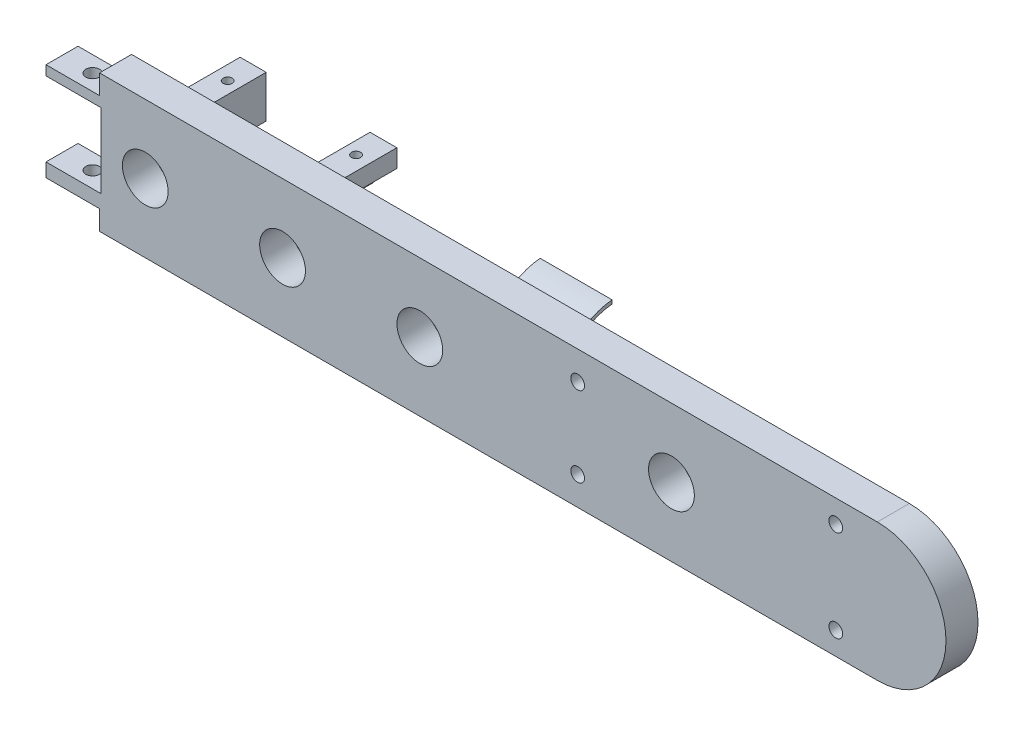
from build123d import *

# Parameters (mm, degrees)
BOSS_EXTRUDE1_DEPTH      = 7
SKETCH2_R                = 5
CUT_EXTRUDE1_DEPTH       = 7
LPATTERN1_COUNT          = 7
LPATTERN1_PITCH          = 30
SKETCH6_R                = 5
CUT_EXTRUDE2_DEPTH       = 10
BOSS_EXTRUDE2_DEPTH      = 21
CUT_EXTRUDE3_DEPTH       = 21
CUT_EXTRUDE4_REACH       = 220.014
SKETCH9_R                = 1.5
CUT_EXTRUDE5_REACH       = 220.771
SKETCH10_W               = 5.271518542
SKETCH10_H               = 23.219312301
BOSS_EXTRUDE3_DEPTH      = 14
CUT_EXTRUDE6_DEPTH       = 1
CUT_EXTRUDE6_DEPTH_BACK  = 22
SKETCH12_W               = 22.7
SKETCH12_H               = 14.642587258
SKETCH12_H_2             = 12.3
CUT_EXTRUDE7_DEPTH       = 7
CUT_EXTRUDE7_DEPTH_BACK  = 7
SKETCH13_R               = 1
CUT_EXTRUDE8_REACH       = 184.393
SKETCH14_W               = 12
SKETCH14_H               = 12
CUT_EXTRUDE11_DEPTH      = 219.013742346
CUT_EXTRUDE11_DEPTH_BACK = 219.013742346
SKETCH16_W               = 140
SKETCH16_H               = 37.19308959
SKETCH17_W               = 7
SKETCH17_H               = 21.4
BOSS_EXTRUDE4_DEPTH      = 11.7
CUT_EXTRUDE12_REACH      = 94.641
SKETCH18_R               = 1.5
CUT_EXTRUDE13_REACH      = 95.925
SKETCH20_W               = 15.728481458
SKETCH20_H               = 11.090838969
SKETCH21_W               = 7
SKETCH21_H               = 16.279991403
CUT_EXTRUDE14_DEPTH      = 12
BOSS_EXTRUDE5_DEPTH      = 7
CUT_EXTRUDE15_DEPTH      = 116.935326799
CUT_EXTRUDE15_DEPTH_BACK = 7
SKETCH23_R               = 1.5


with BuildPart() as part:
    # Sketch1 → Boss-Extrude1 (new body)
    with BuildSketch(Plane.XY):
        with BuildLine():
            Line((-200, 0), (50, 0))
            ThreePointArc((50, 0), (65, -15), (50, -30))
            Line((50, -30), (-200, -30))
            ThreePointArc((-200, -30), (-215, -15), (-200, 0))
        make_face()
    extrude(amount=BOSS_EXTRUDE1_DEPTH)

    # Sketch2 → Cut-Extrude1 (cut)
    with BuildSketch(Plane.XY.offset(7)):
        with Locations((-185, -15)):
            Circle(SKETCH2_R)
    cut_extrude1 = extrude(amount=-CUT_EXTRUDE1_DEPTH, mode=Mode.SUBTRACT)

    # LPattern1: Cut-Extrude1 ×7
    with Locations(*[(i * LPATTERN1_PITCH, 0, 0) for i in range(1, LPATTERN1_COUNT)]):
        add(cut_extrude1, mode=Mode.SUBTRACT)

    # Sketch6 → Cut-Extrude2 (cut)
    with BuildSketch(Plane(origin=(0, 0, 0), x_dir=(-1, 0, 0), z_dir=(0, 0, -1))):
        with Locations((-50, -15)):
            Circle(SKETCH6_R)
    extrude(amount=-CUT_EXTRUDE2_DEPTH, mode=Mode.SUBTRACT)

    # Sketch7 → Boss-Extrude2 (add)
    with BuildSketch(Plane(origin=(0, 0, 0), x_dir=(0, 0, -1), z_dir=(1, 0, 0))):
        with BuildLine():
            Line((20.124409349, -8.046570755), (20.124409349, -21.391782887))
            ThreePointArc((20.124409349, -21.391782887), (10.062204675, -26.149434806), (0, -21.391782887))
            Line((0, -21.391782887), (0, -8.046570755))
            ThreePointArc((0, -8.046570755), (10.062204675, -2.930122505), (20.124409349, -8.046570755))
        make_face()
    extrude(amount=BOSS_EXTRUDE2_DEPTH)

    # Sketch8 → Cut-Extrude3 (cut)
    with BuildSketch(Plane(origin=(21, 0, 0), x_dir=(0, 0, -1), z_dir=(1, 0, 0))):
        with BuildLine():
            Line((0.343653188, -8.603738845), (0.343653188, -21.003738845))
            Line((0.343653188, -21.003738845), (3.251608919, -23.33010343))
            Line((3.251608919, -23.33010343), (6.11482687, -24.672236845))
            Line((6.11482687, -24.672236845), (10.141227113, -25.388041332))
            Line((10.141227113, -25.388041332), (14.122889575, -24.672236845))
            Line((14.122889575, -24.672236845), (17.165058648, -23.33010343))
            Line((17.165058648, -23.33010343), (19.670374355, -20.953281344))
            Line((19.670374355, -20.953281344), (19.670374355, -8.553281344))
            ThreePointArc((19.670374355, -8.553281344), (9.994377841, -3.738573545), (0.343653188, -8.603738845))
        make_face()
    extrude(amount=-CUT_EXTRUDE3_DEPTH, mode=Mode.SUBTRACT)

    # Sketch9 → Cut-Extrude4 (cut, up to next)
    with BuildSketch(Plane(origin=(0, 0, 0), x_dir=(-1, 0, 0), z_dir=(0, 0, -1)), mode=Mode.PRIVATE) as cut_extrude4_sk1:
        with Locations((-29.5, -6.25)):
            Circle(SKETCH9_R)
    cut_extrude4_tool1 = extrude(cut_extrude4_sk1.sketch, amount=-CUT_EXTRUDE4_REACH, mode=Mode.PRIVATE) & part.part
    # Sketch9 → Cut-Extrude4 (cut, up to next)
    with BuildSketch(Plane(origin=(0, 0, 0), x_dir=(-1, 0, 0), z_dir=(0, 0, -1)), mode=Mode.PRIVATE) as cut_extrude4_sk2:
        with Locations((-29.5, -23.75)):
            Circle(SKETCH9_R)
    cut_extrude4_tool2 = extrude(cut_extrude4_sk2.sketch, amount=-CUT_EXTRUDE4_REACH, mode=Mode.PRIVATE) & part.part
    add(cut_extrude4_tool1.solids().sort_by_distance((29.5, -6.25, 0))[0], mode=Mode.SUBTRACT)
    add(cut_extrude4_tool2.solids().sort_by_distance((29.5, -23.75, 0))[0], mode=Mode.SUBTRACT)

    # Cut-Extrude5: up to this face of the body (flat: up to its plane)
    cut_extrude5_end = Plane(part.part.faces().sort_by_distance((-78.33059512, -15.01080435, 0))[0])
    # Sketch10 → Cut-Extrude5 (cut, up to the picked face)
    with BuildSketch(Plane(origin=(0, 0, -20.124409349), x_dir=(-1, 0, 0), z_dir=(0, 0, -1)), mode=Mode.PRIVATE) as cut_extrude5_sk1:
        with Locations((-2.635759271, -14.539778656)):
            Rectangle(SKETCH10_W, SKETCH10_H)
    cut_extrude5_tool1 = split(extrude(cut_extrude5_sk1.sketch, amount=-CUT_EXTRUDE5_REACH, mode=Mode.PRIVATE), bisect_by=cut_extrude5_end, keep=Keep.BOTH, mode=Mode.PRIVATE)
    add(cut_extrude5_tool1.solids().sort_by(Axis((2.635759, -14.539779, -20.124409), (0, 0, 1)))[0], mode=Mode.SUBTRACT)

    # Sketch11 → Boss-Extrude3 (add)
    with BuildSketch(Plane(origin=(0, 0, 0), x_dir=(-1, 0, 0), z_dir=(0, 0, -1))):
        Polygon((60.097644306, -6.420008597), (60.097644306, -23.913431972), (36.21993437, -23.913431972), (36.21993437, -6.613282571), (31.020509523, -6.613282571), (31.020509523, -2.674883318), (65.276628567, -2.674883318), (65.276628567, -6.420008597), align=None)
        Polygon((193.975354243, -6.285954501), (193.975354243, -16.540829221), (170.097644306, -16.540829221), (170.097644306, -6.479228475), (164.898219459, -6.479228475), (164.898219459, -2.540829221), (199.154338504, -2.540829221), (199.154338504, -6.285954501), align=None)
    extrude(amount=BOSS_EXTRUDE3_DEPTH)

    # Sketch12 → Cut-Extrude6 (cut, two sides: drawn at the far end of the back side and taken through both)
    with BuildSketch(Plane(origin=(0, -2.674883318, 0), x_dir=(1, 0, 0), z_dir=(0, 1, 0)).offset(-CUT_EXTRUDE6_DEPTH_BACK)):
        with Locations((-48.226628567, 7.87504546)):
            Rectangle(SKETCH12_W, SKETCH12_H)
        with Locations((-182.104338504, 6.42306456)):
            Rectangle(SKETCH12_W, SKETCH12_H_2)
    extrude(amount=CUT_EXTRUDE6_DEPTH + CUT_EXTRUDE6_DEPTH_BACK, mode=Mode.SUBTRACT)

    # Sketch13 → Cut-Extrude7 (cut, two sides: drawn at the far end of the back side and taken through both)
    with BuildSketch(Plane(origin=(0, -2.674883318, 0), x_dir=(1, 0, 0), z_dir=(0, 1, 0)).offset(-CUT_EXTRUDE7_DEPTH_BACK)):
        with Locations(Location((-167.998219459, 8.19, 0), (0, 0, 90))):
            Circle(SKETCH13_R)
        with Locations(Location((-196.054338504, 8.19, 0), (0, 0, 90))):
            Circle(SKETCH13_R)
        with Locations(Location((-62.176628567, 8.19, 0), (0, 0, 90))):
            Circle(SKETCH13_R)
        with Locations(Location((-34.120509523, 8.19, 0), (0, 0, 90))):
            Circle(SKETCH13_R)
    extrude(amount=CUT_EXTRUDE7_DEPTH + CUT_EXTRUDE7_DEPTH_BACK, mode=Mode.SUBTRACT)

    # Cut-Extrude8: up to this face of the body (flat: up to its plane)
    cut_extrude8_end = Plane(part.part.faces().sort_by_distance((-193.975354243, -11.413391861, -7))[0])
    # Sketch14 → Cut-Extrude8 (cut, up to the picked face)
    with BuildSketch(Plane(origin=(-36.21993437, 0, 0), x_dir=(0, 0, -1), z_dir=(1, 0, 0)), mode=Mode.PRIVATE) as cut_extrude8_sk1:
        with Locations((8, -17.913431972)):
            Rectangle(SKETCH14_W, SKETCH14_H)
    cut_extrude8_tool1 = split(extrude(cut_extrude8_sk1.sketch, amount=-CUT_EXTRUDE8_REACH, mode=Mode.PRIVATE), bisect_by=cut_extrude8_end, keep=Keep.BOTH, mode=Mode.PRIVATE)
    add(cut_extrude8_tool1.solids().sort_by(Axis((-36.219934, -17.913432, -8), (-1, 0, 0)))[0], mode=Mode.SUBTRACT)

    # Sketch16 → Cut-Extrude11 (cut, two sides: drawn at the far end of the back side and taken through both)
    with BuildSketch(Plane(origin=(0, 0, 0), x_dir=(-1, 0, 0), z_dir=(0, 0, -1)).offset(-CUT_EXTRUDE11_DEPTH_BACK)):
        with Locations((145, -15.740579032)):
            Rectangle(SKETCH16_W, SKETCH16_H)
    extrude(amount=CUT_EXTRUDE11_DEPTH + CUT_EXTRUDE11_DEPTH_BACK, mode=Mode.SUBTRACT)

    # Sketch17 → Boss-Extrude4 (add)
    with BuildSketch(Plane.ZY.offset(75)):
        with Locations((3.5, -15)):
            Rectangle(SKETCH17_W, SKETCH17_H)
    extrude(amount=BOSS_EXTRUDE4_DEPTH)

    # Sketch18 → Cut-Extrude12 (cut, up to next)
    with BuildSketch(Plane(origin=(0, -4.3, 0), x_dir=(1, 0, 0), z_dir=(0, 1, 0)), mode=Mode.PRIVATE) as cut_extrude12_sk1:
        with Locations(Location((-80, -3.5, 0), (0, 0, 270))):
            Circle(SKETCH18_R)
    cut_extrude12_tool1 = extrude(cut_extrude12_sk1.sketch, amount=-CUT_EXTRUDE12_REACH, mode=Mode.PRIVATE) & part.part
    add(cut_extrude12_tool1.solids().sort_by_distance((-80, -4.3, 3.5))[0], mode=Mode.SUBTRACT)

    # Sketch20 → Cut-Extrude13 (cut, up to next)
    with BuildSketch(Plane(origin=(0, 0, 0), x_dir=(1, 0, 0), z_dir=(0, 1, 0)), mode=Mode.PRIVATE) as cut_extrude13_sk1:
        with Locations((13.135759271, 14.578989865)):
            Rectangle(SKETCH20_W, SKETCH20_H)
    cut_extrude13_tool1 = extrude(cut_extrude13_sk1.sketch, amount=-CUT_EXTRUDE13_REACH, mode=Mode.PRIVATE) & part.part
    add(cut_extrude13_tool1.solids().sort_by_distance((13.135759, 0, -14.57899))[0], mode=Mode.SUBTRACT)

    # Sketch21 → Cut-Extrude14 (cut)
    with BuildSketch(Plane.ZY.offset(86.7)):
        with Locations((3.5, -14.560004299)):
            Rectangle(SKETCH21_W, SKETCH21_H)
    extrude(amount=-CUT_EXTRUDE14_DEPTH, mode=Mode.SUBTRACT)

    # Sketch22 → Boss-Extrude5 (add)
    with BuildSketch(Plane(origin=(0, 0, 0), x_dir=(-1, 0, 0), z_dir=(0, 0, -1))):
        with BuildLine():
            ThreePointArc((-50, -20), (-55, -15), (-50, -10))
            Line((-50, -10), (-50, 0))
            Line((-50, 0), (-95, 0))
            ThreePointArc((-95, 0), (-110, -15), (-95, -30))
            Line((-95, -30), (-50, -30))
            Line((-50, -30), (-50, -20))
        make_face()
    extrude(amount=-BOSS_EXTRUDE5_DEPTH)

    # Sketch23 → Cut-Extrude15 (cut, two sides: drawn at the far end of the back side and taken through both)
    with BuildSketch(Plane.XY.offset(7).offset(-CUT_EXTRUDE15_DEPTH_BACK)):
        with Locations(Location((85.914550285, -25, 0), (0, 0, 180))):
            Circle(SKETCH23_R)
        with Locations(Location((85.914550285, -5, 0), (0, 0, 180))):
            Circle(SKETCH23_R)
    extrude(amount=CUT_EXTRUDE15_DEPTH + CUT_EXTRUDE15_DEPTH_BACK, mode=Mode.SUBTRACT)


solid = part.part
